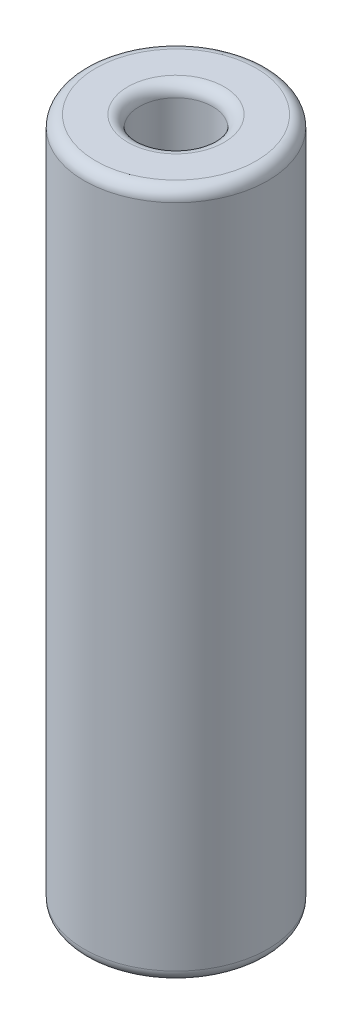
from build123d import *

# Parameters (mm, degrees)
SKETCH1_R           = 5.08
SKETCH1_R_2         = 2.032
BOSS_EXTRUDE1_DEPTH = 38.1
FILLET1_R           = 0.635


with BuildPart() as part:
    # Sketch1 → Boss-Extrude1 (new body)
    with BuildSketch(Plane(origin=(0, 0, 0), x_dir=(1, 0, 0), z_dir=(0, 1, 0))):
        with Locations(Location((0, 0, 0), (0, 0, 90))):
            Circle(SKETCH1_R)
        with Locations(Location((0, 0, 0), (0, 0, 90))):
            Circle(SKETCH1_R_2, mode=Mode.SUBTRACT)
    extrude(amount=BOSS_EXTRUDE1_DEPTH)

    # Fillet1
    fillet1_edges = [part.edges().sort_by_distance(p)[0] for p in [
        (0, 0, 5.08),
        (0, 38.1, 5.08),
        (0, 0, 2.032),
        (0, 38.1, 2.032),
    ]]
    fillet(fillet1_edges, radius=FILLET1_R)


solid = part.part
